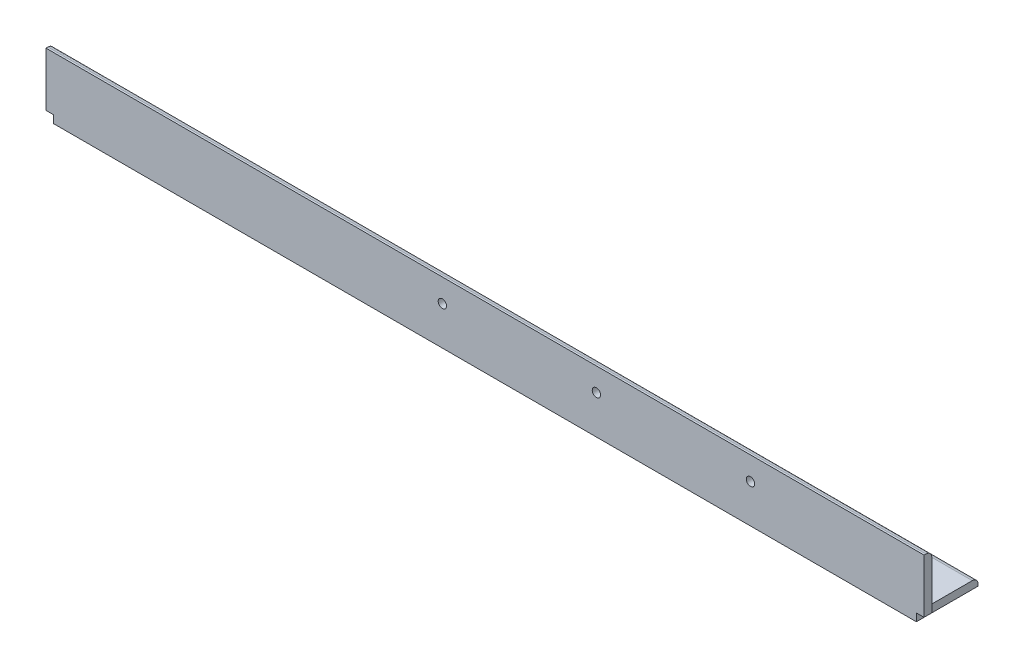
from build123d import *

# Parameters (mm, degrees)
BOSS_EXTRUDE1_DEPTH       = 180.975
SKETCH3_W                 = 3.175
SKETCH3_H                 = 3.175
CUT_EXTRUDE2_DEPTH        = 185.505475867
F_8_32_TAPPED_HOLE1_D     = 3.4544
F_8_32_TAPPED_HOLE2_D     = 3.4544
F_8_32_TAPPED_HOLE2_DEPTH = 10.668
F_8_32_TAPPED_HOLE2_TIP   = 1.037806461
FILLET1_R                 = 3.175
FILLET2_R                 = 2.3622


with BuildPart() as part:
    # Sketch1 → Boss-Extrude1 (new, symmetric)
    with BuildSketch(Plane(origin=(0, 0, 0), x_dir=(0, 0, -1), z_dir=(1, 0, 0))):
        Polygon((0, 0), (0, 25.4), (3.175, 25.4), (3.175, 3.175), (25.4, 3.175), (25.4, 0), align=None)
    extrude(amount=BOSS_EXTRUDE1_DEPTH, both=True)

    # Sketch3 → Cut-Extrude2 (cut, through all)
    with BuildSketch(Plane(origin=(0, 0, -25.4), x_dir=(-1, 0, 0), z_dir=(0, 0, -1))):
        with Locations((-179.3875, 1.5875)):
            Rectangle(SKETCH3_W, SKETCH3_H)
    cut_extrude2 = extrude(amount=-CUT_EXTRUDE2_DEPTH, mode=Mode.SUBTRACT)

    # Mirror2: Cut-Extrude2 across plane
    add(cut_extrude2.mirror(Plane(origin=(0, 0, 0), x_dir=(0, 0, 1), z_dir=(1, 0, 0))), mode=Mode.SUBTRACT)

    # #8-32 Tapped Hole1 (through all)
    with Locations(Plane.XY):
        with Locations((109.4105, 15.875), (45.9105, 15.875), (-17.5895, 15.875)):
            Hole(F_8_32_TAPPED_HOLE1_D / 2)

    # #8-32 Tapped Hole2
    with Locations(Plane(origin=(0, 3.175, 0), x_dir=(-1, 0, 0), z_dir=(0, 1, 0))):
        with Locations((131.953, -13.335), (-131.953, -13.335)):
            Hole(F_8_32_TAPPED_HOLE2_D / 2, depth=F_8_32_TAPPED_HOLE2_DEPTH)
            with Locations((0, 0, -(F_8_32_TAPPED_HOLE2_DEPTH + F_8_32_TAPPED_HOLE2_TIP / 2))):  # 118° drill point
                Cone(0, F_8_32_TAPPED_HOLE2_D / 2, F_8_32_TAPPED_HOLE2_TIP, mode=Mode.SUBTRACT)

    # Fillet1
    fillet1_edges = [part.edges().sort_by_distance(p)[0] for p in [
        (0, 3.175, -3.175),
    ]]
    fillet(fillet1_edges, radius=FILLET1_R)

    # Fillet2
    fillet2_edges = [part.edges().sort_by_distance(p)[0] for p in [
        (0, 25.4, -3.175),
        (0, 3.175, -25.4),
    ]]
    fillet(fillet2_edges, radius=FILLET2_R)


solid = part.part
